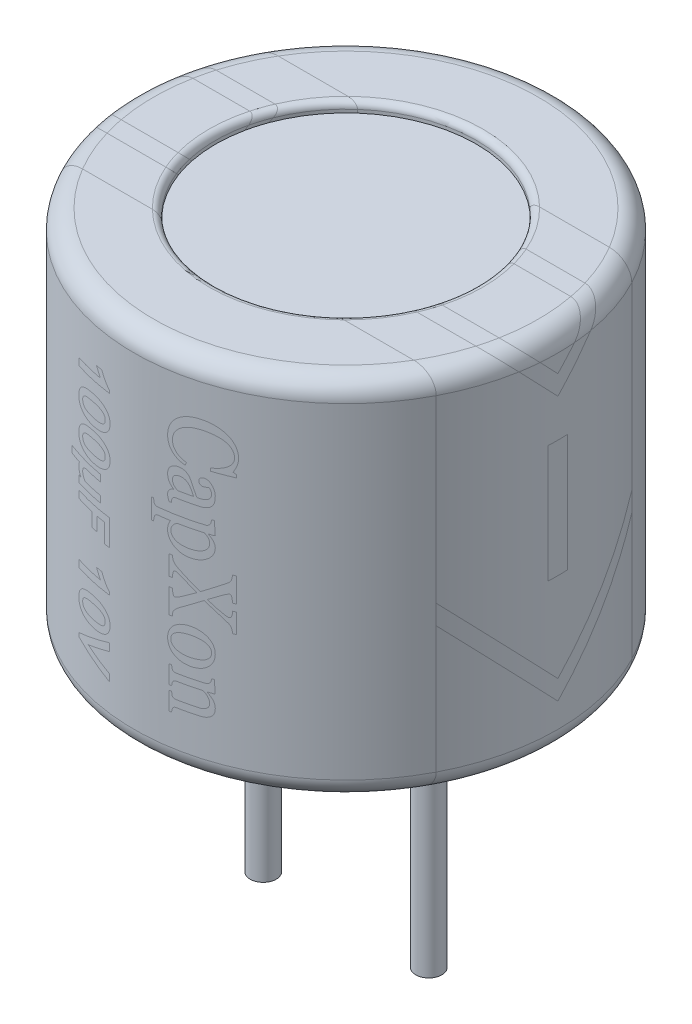
from build123d import *

# Parameters (mm, degrees)
SKETCH_1_R          = 3.25
EXTRUDE_1_DEPTH     = 5.6
SKETCH_2_R          = 2
CUT_EXTRUDE_1_DEPTH = 0.15
CUT_EXTRUDE_START   = -0.15
SKETCH_3_R          = 2
CUT_EXTRUDE_2_DEPTH = 0.15
SKETCH_4_R          = 0.2
EXTRUDE_2_DEPTH     = 4
EXTRUDE_2_2_DEPTH   = 4
FILLET_1_R          = 0.3
FILLET_2_R          = 0.1


with BuildPart() as part:
    # Эскиз1 → Бобышка-Вытянуть1 (new body)
    with BuildSketch(Plane(origin=(0, 0, 0), x_dir=(1, 0, 0), z_dir=(0, 1, 0))):
        with Locations(Location((0, 0, 0), (0, 0, 270))):
            Circle(SKETCH_1_R)
    extrude(amount=EXTRUDE_1_DEPTH)

    # Эскиз2 → Вырез-Вытянуть1 (cut)
    with BuildSketch(Plane(origin=(0, 5.6, 0), x_dir=(1, 0, 0), z_dir=(0, 1, 0))):
        with Locations(Location((0, 0, 0), (0, 0, 270))):
            Circle(SKETCH_2_R)
    extrude(amount=-CUT_EXTRUDE_1_DEPTH, mode=Mode.SUBTRACT)

    # Эскиз3 → Вырез-Вытянуть2 (cut)
    with BuildSketch(Plane.XZ.offset(CUT_EXTRUDE_START)):
        with Locations(Location((0, 0, 0), (0, 0, 90))):
            Circle(SKETCH_3_R)
    extrude(amount=CUT_EXTRUDE_2_DEPTH, mode=Mode.SUBTRACT)

    # Скругление1
    fillet_1_edges = [part.edges().sort_by_distance(p)[0] for p in [
        (0, 0, -3.25),
        (0, 5.6, -3.25),
    ]]
    fillet(fillet_1_edges, radius=FILLET_1_R)

    # Скругление2
    fillet_2_edges = [part.edges().sort_by_distance(p)[0] for p in [
        (0, 0, -2),
        (0, 5.6, -2),
    ]]
    fillet(fillet_2_edges, radius=FILLET_2_R)


with BuildPart() as body_2:
    # Эскиз4 → Бобышка-Вытянуть2 (new body)
    with BuildSketch(Plane.XZ.offset(-0.15)):
        with Locations(Location((-1.27, 0, 0), (0, 0, 270))):
            Circle(SKETCH_4_R)
    extrude(amount=EXTRUDE_2_DEPTH)


with BuildPart() as body_3:
    # Эскиз4 → Extrude 2 2 (new body)
    with BuildSketch(Plane.XZ.offset(-0.15)):
        with Locations(Location((1.27, 0, 0), (0, 0, 90))):
            Circle(SKETCH_4_R)
    extrude(amount=EXTRUDE_2_2_DEPTH)


solid = Compound([part.part, body_2.part, body_3.part])
